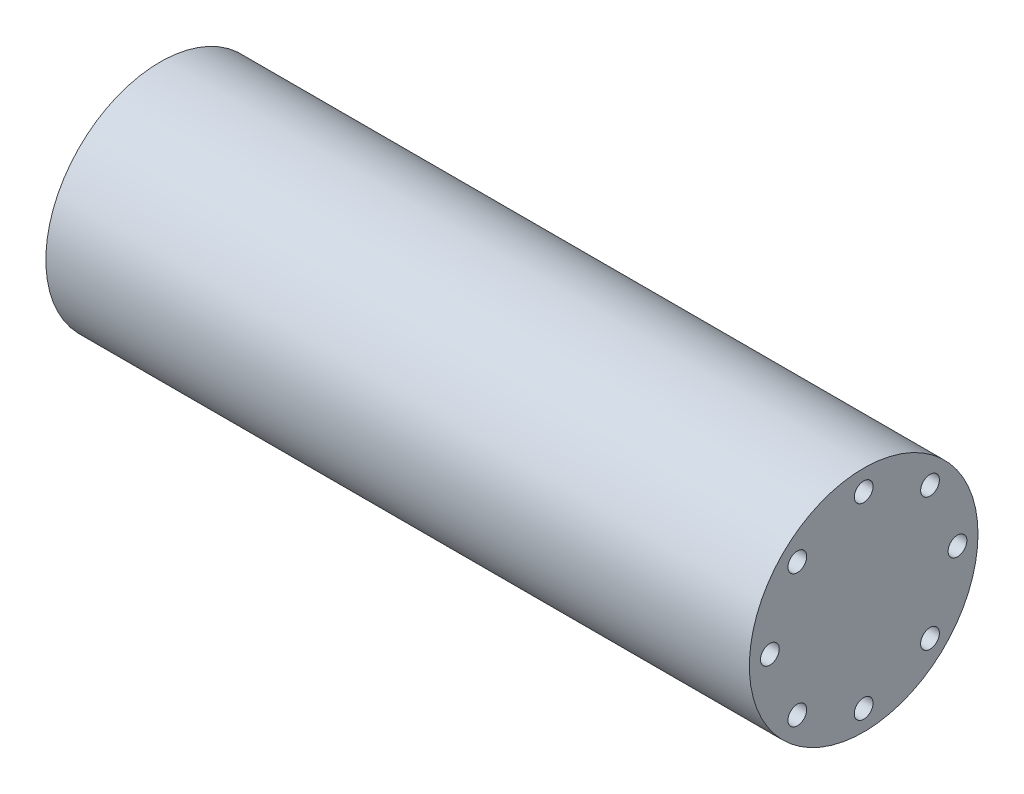
from build123d import *

# Parameters (mm, degrees)
SKETCH1_R                  = 9.75
BOSS_EXTRUDE1_DEPTH        = 60
M2_TAPPED_HOLE1_AT_2_COUNT = 2
M2_TAPPED_HOLE1_AT_2_PITCH = 6.122934918
M2_TAPPED_HOLE1_AT_3_COUNT = 2
M2_TAPPED_HOLE1_AT_3_PITCH = 11.313708499
M2_TAPPED_HOLE1_AT_4_COUNT = 2
M2_TAPPED_HOLE1_AT_4_PITCH = 14.78207252
M2_TAPPED_HOLE1_AT_5_COUNT = 2
M2_TAPPED_HOLE1_AT_5_PITCH = 16
M2_TAPPED_HOLE1_AT_6_COUNT = 2
M2_TAPPED_HOLE1_AT_6_PITCH = 14.78207252
M2_TAPPED_HOLE1_AT_7_COUNT = 2
M2_TAPPED_HOLE1_AT_7_PITCH = 11.313708499
M2_TAPPED_HOLE1_AT_8_COUNT = 2
M2_TAPPED_HOLE1_AT_8_PITCH = 6.122934918


with BuildPart() as part:
    # Sketch1 → Boss-Extrude1 (new body)
    with BuildSketch(Plane(origin=(0, 0, 0), x_dir=(0, 0, -1), z_dir=(1, 0, 0))):
        Circle(SKETCH1_R)
    extrude(amount=BOSS_EXTRUDE1_DEPTH)

    # Sketch4 → M2 Tapped Hole1 (revolve, cut)
    with BuildSketch(Plane(origin=(60, 8, 0), x_dir=(0, 0, -1), z_dir=(0, 1, 0))):
        Polygon((0, 0), (0, 5.680688495), (0.8, 5.2), (0.8, 0), align=None)
    m2_tapped_hole1 = revolve(axis=Axis((66.35, 8, 0), (-1, 0, 0)), mode=Mode.SUBTRACT)

    # M2 Tapped Hole1 at 2: M2 Tapped Hole1 ×2
    with Locations(*[Vector(0, -0.3826834323650503, -0.9238795325113031) * (i * M2_TAPPED_HOLE1_AT_2_PITCH) for i in range(1, M2_TAPPED_HOLE1_AT_2_COUNT)]):
        add(m2_tapped_hole1, mode=Mode.SUBTRACT)

    # M2 Tapped Hole1 at 3: M2 Tapped Hole1 ×2
    with Locations(*[Vector(0, -0.7071067811865174, -0.7071067811865777) * (i * M2_TAPPED_HOLE1_AT_3_PITCH) for i in range(1, M2_TAPPED_HOLE1_AT_3_COUNT)]):
        add(m2_tapped_hole1, mode=Mode.SUBTRACT)

    # M2 Tapped Hole1 at 4: M2 Tapped Hole1 ×2
    with Locations(*[Vector(0, -0.9238795325112705, -0.38268343236512903) * (i * M2_TAPPED_HOLE1_AT_4_PITCH) for i in range(1, M2_TAPPED_HOLE1_AT_4_COUNT)]):
        add(m2_tapped_hole1, mode=Mode.SUBTRACT)

    # M2 Tapped Hole1 at 5: M2 Tapped Hole1 ×2
    with Locations(*[(0, -i * M2_TAPPED_HOLE1_AT_5_PITCH, 0) for i in range(1, M2_TAPPED_HOLE1_AT_5_COUNT)]):
        add(m2_tapped_hole1, mode=Mode.SUBTRACT)

    # M2 Tapped Hole1 at 6: M2 Tapped Hole1 ×2
    with Locations(*[Vector(0, -0.9238795325113031, 0.3826834323650506) * (i * M2_TAPPED_HOLE1_AT_6_PITCH) for i in range(1, M2_TAPPED_HOLE1_AT_6_COUNT)]):
        add(m2_tapped_hole1, mode=Mode.SUBTRACT)

    # M2 Tapped Hole1 at 7: M2 Tapped Hole1 ×2
    with Locations(*[Vector(0, -0.7071067811865777, 0.7071067811865174) * (i * M2_TAPPED_HOLE1_AT_7_PITCH) for i in range(1, M2_TAPPED_HOLE1_AT_7_COUNT)]):
        add(m2_tapped_hole1, mode=Mode.SUBTRACT)

    # M2 Tapped Hole1 at 8: M2 Tapped Hole1 ×2
    with Locations(*[Vector(0, -0.3826834323651289, 0.9238795325112706) * (i * M2_TAPPED_HOLE1_AT_8_PITCH) for i in range(1, M2_TAPPED_HOLE1_AT_8_COUNT)]):
        add(m2_tapped_hole1, mode=Mode.SUBTRACT)

    # Mirror1: M2 Tapped Hole1 across plane
    add(m2_tapped_hole1.mirror(Plane(origin=(30, 0, 0), x_dir=(0, 0, 1), z_dir=(1, 0, 0))), mode=Mode.SUBTRACT)

    # Mirror1 copy 1 sketch → Mirror1 copy 1 (revolve, cut)
    with BuildSketch(Plane(origin=(0, 5.656854249, -5.656854249), x_dir=(0, 0, -1), z_dir=(0, 1, 0))):
        Polygon((0, 0), (0, -5.680688495), (0.8, -5.2), (0.8, 0), align=None)
    revolve(axis=Axis((-6.35, 5.656854249, -5.656854249), (-1, 0, 0)), mode=Mode.SUBTRACT)

    # Mirror1 copy 2 sketch → Mirror1 copy 2 (revolve, cut)
    with BuildSketch(Plane(origin=(0, 0, -8), x_dir=(0, 0, -1), z_dir=(0, 1, 0))):
        Polygon((0, 0), (0, -5.680688495), (0.8, -5.2), (0.8, 0), align=None)
    revolve(axis=Axis((-6.35, 0, -8), (-1, 0, 0)), mode=Mode.SUBTRACT)

    # Mirror1 copy 3 sketch → Mirror1 copy 3 (revolve, cut)
    with BuildSketch(Plane(origin=(0, -5.656854249, -5.656854249), x_dir=(0, 0, -1), z_dir=(0, 1, 0))):
        Polygon((0, 0), (0, -5.680688495), (0.8, -5.2), (0.8, 0), align=None)
    revolve(axis=Axis((-6.35, -5.656854249, -5.656854249), (-1, 0, 0)), mode=Mode.SUBTRACT)

    # Mirror1 copy 4 sketch → Mirror1 copy 4 (revolve, cut)
    with BuildSketch(Plane(origin=(0, -8, 0), x_dir=(0, 0, -1), z_dir=(0, 1, 0))):
        Polygon((0, 0), (0, -5.680688495), (0.8, -5.2), (0.8, 0), align=None)
    revolve(axis=Axis((-6.35, -8, 0), (-1, 0, 0)), mode=Mode.SUBTRACT)

    # Mirror1 copy 5 sketch → Mirror1 copy 5 (revolve, cut)
    with BuildSketch(Plane(origin=(0, -5.656854249, 5.656854249), x_dir=(0, 0, -1), z_dir=(0, 1, 0))):
        Polygon((0, 0), (0, -5.680688495), (0.8, -5.2), (0.8, 0), align=None)
    revolve(axis=Axis((-6.35, -5.656854249, 5.656854249), (-1, 0, 0)), mode=Mode.SUBTRACT)

    # Mirror1 copy 6 sketch → Mirror1 copy 6 (revolve, cut)
    with BuildSketch(Plane(origin=(0, 0, 8), x_dir=(0, 0, -1), z_dir=(0, 1, 0))):
        Polygon((0, 0), (0, -5.680688495), (0.8, -5.2), (0.8, 0), align=None)
    revolve(axis=Axis((-6.35, 0, 8), (-1, 0, 0)), mode=Mode.SUBTRACT)

    # Mirror1 copy 7 sketch → Mirror1 copy 7 (revolve, cut)
    with BuildSketch(Plane(origin=(0, 5.656854249, 5.656854249), x_dir=(0, 0, -1), z_dir=(0, 1, 0))):
        Polygon((0, 0), (0, -5.680688495), (0.8, -5.2), (0.8, 0), align=None)
    revolve(axis=Axis((-6.35, 5.656854249, 5.656854249), (-1, 0, 0)), mode=Mode.SUBTRACT)


solid = part.part
